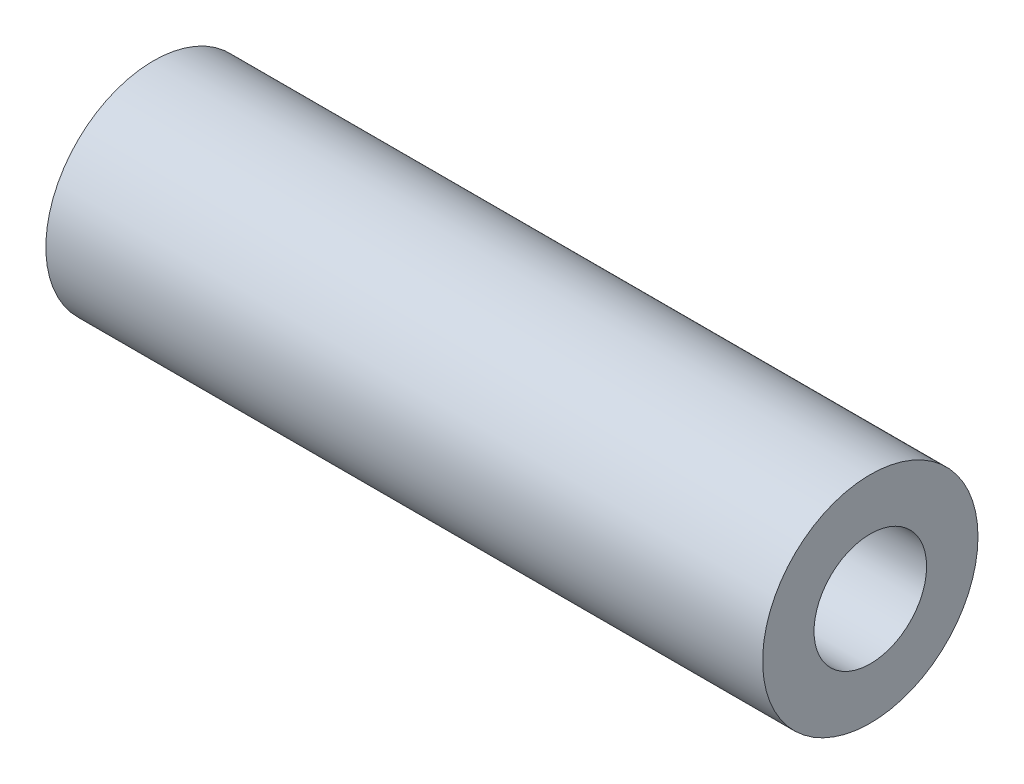
from build123d import *

# Parameters (mm, degrees)
SKETCH1_R           = 4.7625
SKETCH1_R_2         = 2.4892
BOSS_EXTRUDE1_DEPTH = 15.8496


with BuildPart() as part:
    # Sketch1 → Boss-Extrude1 (new, symmetric)
    with BuildSketch(Plane(origin=(0, 0, 0), x_dir=(0, 0, -1), z_dir=(1, 0, 0))):
        Circle(SKETCH1_R)
        Circle(SKETCH1_R_2, mode=Mode.SUBTRACT)
    extrude(amount=BOSS_EXTRUDE1_DEPTH, both=True)


solid = part.part
